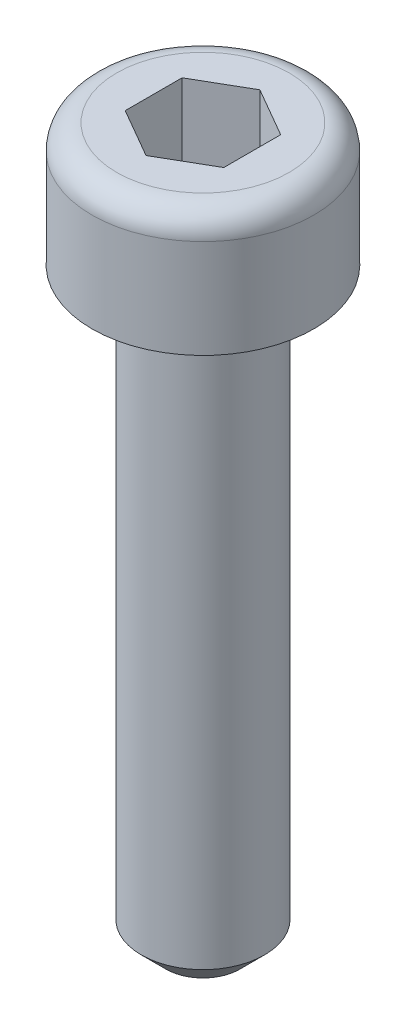
from build123d import *

# Parameters (mm, degrees)
CORTAR_EXTRUIR1_DEPTH = 2
CHAFL_N1_SIZE         = 0.5
REDONDEO1_R           = 0.5


with BuildPart() as part:
    # Croquis1 → Revolución1 (revolve)
    with BuildSketch(Plane.XY, mode=Mode.PRIVATE) as revoluci_n1_sk:
        Polygon((0, 0), (2.25, 0), (2.25, -2.5), (1.25, -2.5), (1.25, -14.5), (0, -14.5), align=None)
    revolve(revoluci_n1_sk.sketch.rotate(Axis((0, 0, 0), (0, -1, 0)), 90), axis=Axis((0, 0, 0), (0, -1, 0)))

    # Croquis2 → Cortar-Extruir1 (cut)
    with BuildSketch(Plane(origin=(0, 0, 0), x_dir=(1, 0, 0), z_dir=(0, 1, 0))):
        Polygon((1, 0.577350269), (0, 1.154700538), (-1, 0.577350269), (-1, -0.577350269), (0, -1.154700538), (1, -0.577350269), align=None)
    extrude(amount=-CORTAR_EXTRUIR1_DEPTH, mode=Mode.SUBTRACT)

    # Chaflán1
    chafl_n1_edges = [part.edges().sort_by_distance(p)[0] for p in [
        (0, -14.5, -1.25),
    ]]
    chamfer(chafl_n1_edges, length=CHAFL_N1_SIZE)

    # Redondeo1
    redondeo1_edges = [part.edges().sort_by_distance(p)[0] for p in [
        (0, 0, -2.25),
    ]]
    fillet(redondeo1_edges, radius=REDONDEO1_R)


solid = part.part
